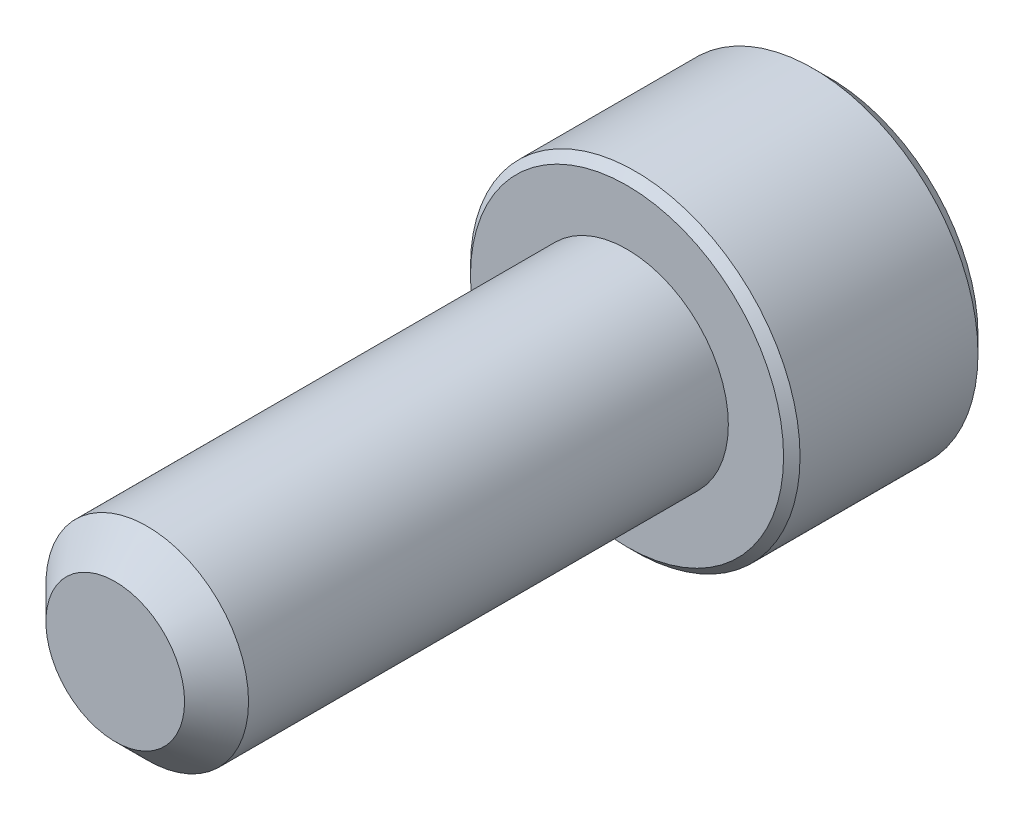
from build123d import *

# Parameters (mm, degrees)
SKETCH1_R          = 1.2573
EXTRUDE1_DEPTH     = 6.35
CHAMFER3_SIZE      = 0.396875
SKETCH6_R          = 2.0447
EXTRUDE2_DEPTH     = 2.5146
CUT_EXTRUDE1_DEPTH = 1.48828125
CHAMFER1_SIZE      = 0.20447
CHAMFER2_SIZE      = 0.102235


with BuildPart() as part:
    # Sketch1 → Extrude1 (new body)
    with BuildSketch(Plane.XY):
        Circle(SKETCH1_R)
    extrude(amount=-EXTRUDE1_DEPTH)

    # Chamfer3
    chamfer3_edges = [part.edges().sort_by_distance(p)[0] for p in [
        (-1.2573, 0, 0),
    ]]
    chamfer(chamfer3_edges, length=CHAMFER3_SIZE)

    # Sketch6 → Extrude2 (add)
    with BuildSketch(Plane(origin=(0, 0, -6.35), x_dir=(-1, 0, 0), z_dir=(0, 0, -1))):
        Circle(SKETCH6_R)
    extrude(amount=EXTRUDE2_DEPTH)

    # Sketch7 → Cut-Extrude1 (cut)
    with BuildSketch(Plane(origin=(0, 0, -8.8646), x_dir=(-1, 0, 0), z_dir=(0, 0, -1))):
        Polygon((0, 1.14567944), (-0.9921875, 0.57283972), (-0.9921875, -0.57283972), (0, -1.14567944), (0.9921875, -0.57283972), (0.9921875, 0.57283972), align=None)
    extrude(amount=-CUT_EXTRUDE1_DEPTH, mode=Mode.SUBTRACT)

    # Cut-Extrude2 cone 1 section (through the dimple's axis) → Cut-Extrude2 (revolve, cut)
    with BuildSketch(Plane(origin=(0, 0, -8.8646), x_dir=(0, 1, 0), z_dir=(1, 0, 0))):
        Polygon((0, 0), (1.14567944, 0), (0, 1.14567944), align=None)
    revolve(axis=Axis((0, 0, -8.8646), (0, 0, 1)), mode=Mode.SUBTRACT)

    # Chamfer1
    chamfer1_edges = [part.edges().sort_by_distance(p)[0] for p in [
        (2.0447, 0, -8.8646),
    ]]
    chamfer(chamfer1_edges, length=CHAMFER1_SIZE)

    # Chamfer2
    chamfer2_edges = [part.edges().sort_by_distance(p)[0] for p in [
        (2.0447, 0, -6.35),
    ]]
    chamfer(chamfer2_edges, length=CHAMFER2_SIZE)


solid = part.part
